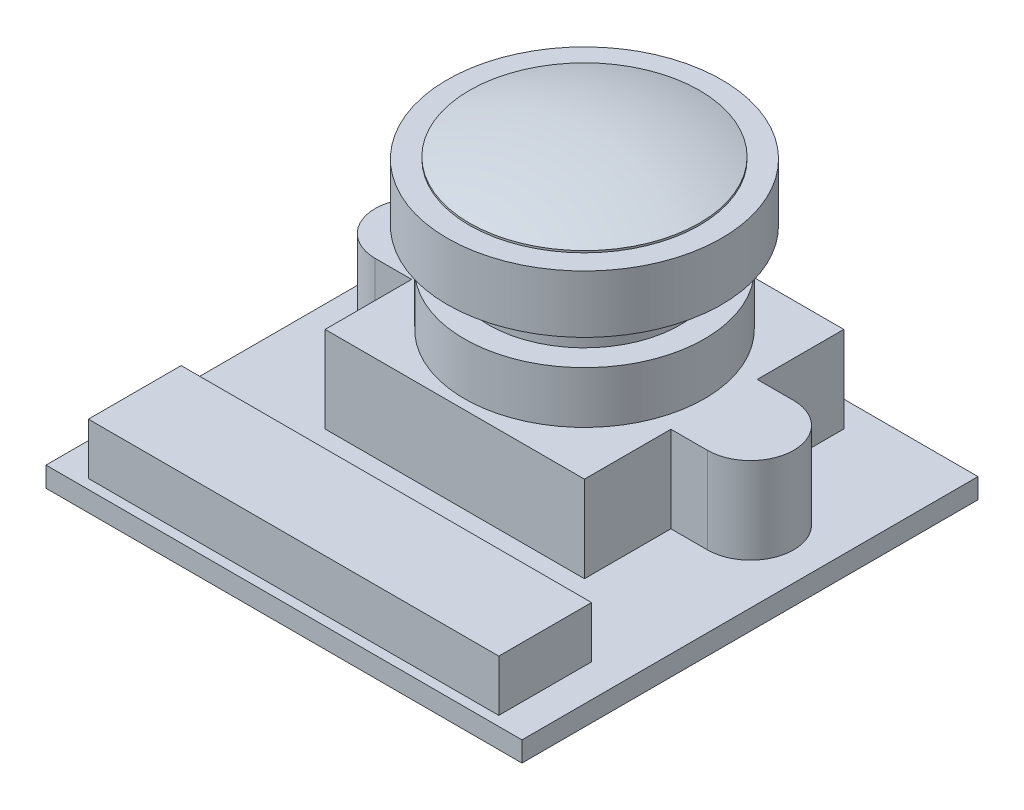
from build123d import *

# Parameters (mm, degrees)
SKETCH1_W           = 24.83
SKETCH1_H           = 23.79
BOSS_EXTRUDE1_DEPTH = 1.05
BOSS_EXTRUDE2_DEPTH = 4.5
SKETCH3_W           = 21.41
SKETCH3_H           = 4.84
BOSS_EXTRUDE3_DEPTH = 2.68
SKETCH4_R           = 6.265
BOSS_EXTRUDE4_DEPTH = 2.7
SKETCH5_R           = 5
BOSS_EXTRUDE5_DEPTH = 2
SKETCH6_R           = 7.16
BOSS_EXTRUDE6_DEPTH = 3
SKETCH7_R           = 6
BOSS_EXTRUDE7_DEPTH = 0.1
DOME2_FACE_RADIUS   = 6
DOME2_HEIGHT        = 1


with BuildPart() as part:
    # Sketch1 → Boss-Extrude1 (new body)
    with BuildSketch(Plane(origin=(0, 0, 0), x_dir=(1, 0, 0), z_dir=(0, 1, 0))):
        with Locations((12.415, 11.895)):
            Rectangle(SKETCH1_W, SKETCH1_H)
    extrude(amount=BOSS_EXTRUDE1_DEPTH)

    # Sketch2 → Boss-Extrude2 (add)
    with BuildSketch(Plane(origin=(0, 1.05, 0), x_dir=(1, 0, 0), z_dir=(0, 1, 0))):
        with BuildLine():
            Line((3.745, 17.925), (5.65, 17.925))
            Line((5.65, 17.925), (5.65, 22.44))
            Line((5.65, 22.44), (19.18, 22.44))
            Line((19.18, 22.44), (19.18, 17.92))
            Line((19.18, 17.92), (21.085, 17.92))
            ThreePointArc((21.085, 17.92), (23.335, 15.67), (21.085, 13.42))
            Line((21.085, 13.42), (19.18, 13.42))
            Line((19.18, 13.42), (19.18, 8.91))
            Line((19.18, 8.91), (5.65, 8.91))
            Line((5.65, 8.91), (5.65, 13.425))
            Line((5.65, 13.425), (3.745, 13.425))
            ThreePointArc((3.745, 13.425), (1.495, 15.675), (3.745, 17.925))
        make_face()
    extrude(amount=BOSS_EXTRUDE2_DEPTH)

    # Sketch3 → Boss-Extrude3 (add)
    with BuildSketch(Plane(origin=(0, 1.05, 0), x_dir=(1, 0, 0), z_dir=(0, 1, 0))):
        with Locations((12.415, 2.92)):
            Rectangle(SKETCH3_W, SKETCH3_H)
    extrude(amount=BOSS_EXTRUDE3_DEPTH)

    # Sketch4 → Boss-Extrude4 (add)
    with BuildSketch(Plane(origin=(0, 5.55, 0), x_dir=(1, 0, 0), z_dir=(0, 1, 0))):
        with Locations(Location((12.415, 15.675, 0), (0, 0, 90))):
            Circle(SKETCH4_R)
    extrude(amount=BOSS_EXTRUDE4_DEPTH)

    # Sketch5 → Boss-Extrude5 (add)
    with BuildSketch(Plane(origin=(0, 8.25, 0), x_dir=(1, 0, 0), z_dir=(0, 1, 0))):
        with Locations(Location((12.415, 15.675, 0), (0, 0, 270))):
            Circle(SKETCH5_R)
    extrude(amount=BOSS_EXTRUDE5_DEPTH)

    # Sketch6 → Boss-Extrude6 (add)
    with BuildSketch(Plane(origin=(0, 10.25, 0), x_dir=(1, 0, 0), z_dir=(0, 1, 0))):
        with Locations(Location((12.415, 15.675, 0), (0, 0, 270))):
            Circle(SKETCH6_R)
    extrude(amount=BOSS_EXTRUDE6_DEPTH)

    # Sketch7 → Boss-Extrude7 (add)
    with BuildSketch(Plane(origin=(0, 13.25, 0), x_dir=(1, 0, 0), z_dir=(0, 1, 0))):
        with Locations(Location((12.415, 15.675, 0), (0, 0, 270))):
            Circle(SKETCH7_R)
    extrude(amount=BOSS_EXTRUDE7_DEPTH)

    # Dome2: a dome of height H over a round flat face of radius A is a cap of a sphere of radius (A * A + H * H) / (2 * H)
    dome2_r = (DOME2_FACE_RADIUS * DOME2_FACE_RADIUS + DOME2_HEIGHT * DOME2_HEIGHT) / (2 * DOME2_HEIGHT)
    dome2_base = Plane((12.415, 13.35, -15.675), z_dir=(0, 1, 0))
    with Locations(dome2_base.offset(DOME2_HEIGHT - dome2_r)):
        dome2_ball = Sphere(dome2_r, mode=Mode.PRIVATE)
    add(split(dome2_ball, bisect_by=dome2_base, keep=Keep.TOP, mode=Mode.PRIVATE))


solid = part.part
